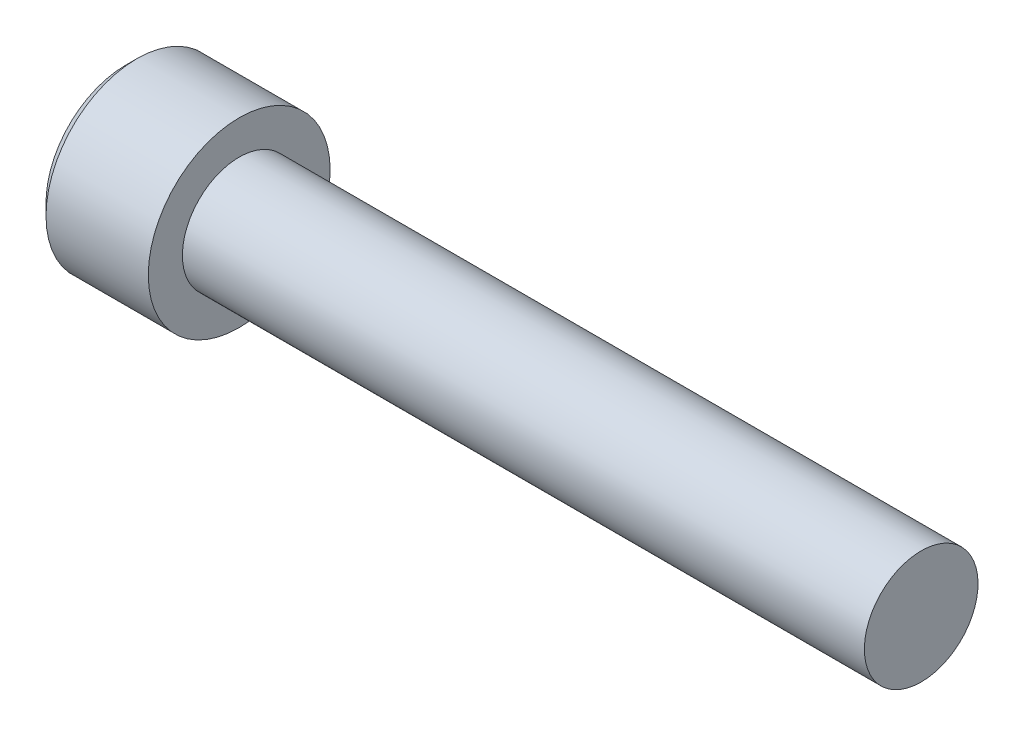
from build123d import *

# Parameters (mm, degrees)
CUT_EXTRUDE1_DEPTH = 5
CHAMFER1_SIZE      = 1


with BuildPart() as part:
    # Sketch1 → Revolve1 (revolve)
    with BuildSketch(Plane.XY, mode=Mode.PRIVATE) as revolve1_sk:
        Polygon((0, 5), (60, 5), (60, 0), (-10, 0), (-10, 8), (0, 8), align=None)
    revolve(revolve1_sk.sketch.rotate(Axis((-10, 0, 0), (1, 0, 0)), 180), axis=Axis((-10, 0, 0), (1, 0, 0)))

    # Sketch2 → Cut-Revolve1 (revolve, cut)
    with BuildSketch(Plane.XY, mode=Mode.PRIVATE) as cut_revolve1_sk:
        Polygon((-10, 4), (-5, 4), (-2.596557524, 0), (-10, 0), align=None)
    revolve(cut_revolve1_sk.sketch.rotate(Axis((-2.596557524, 0, 0), (-1, 0, 0)), 90), axis=Axis((-2.596557524, 0, 0), (-1, 0, 0)), mode=Mode.SUBTRACT)

    # Sketch3 → Cut-Extrude1 (cut)
    with BuildSketch(Plane.ZY.offset(10)):
        Polygon((4, 2.309401077), (0, 4.618802154), (-4, 2.309401077), (-4, -2.309401077), (0, -4.618802154), (4, -2.309401077), align=None)
    extrude(amount=-CUT_EXTRUDE1_DEPTH, mode=Mode.SUBTRACT)

    # Chamfer1
    chamfer1_edges = [part.edges().sort_by_distance(p)[0] for p in [
        (-10, 8, 0),
    ]]
    chamfer(chamfer1_edges, length=CHAMFER1_SIZE)


solid = part.part
